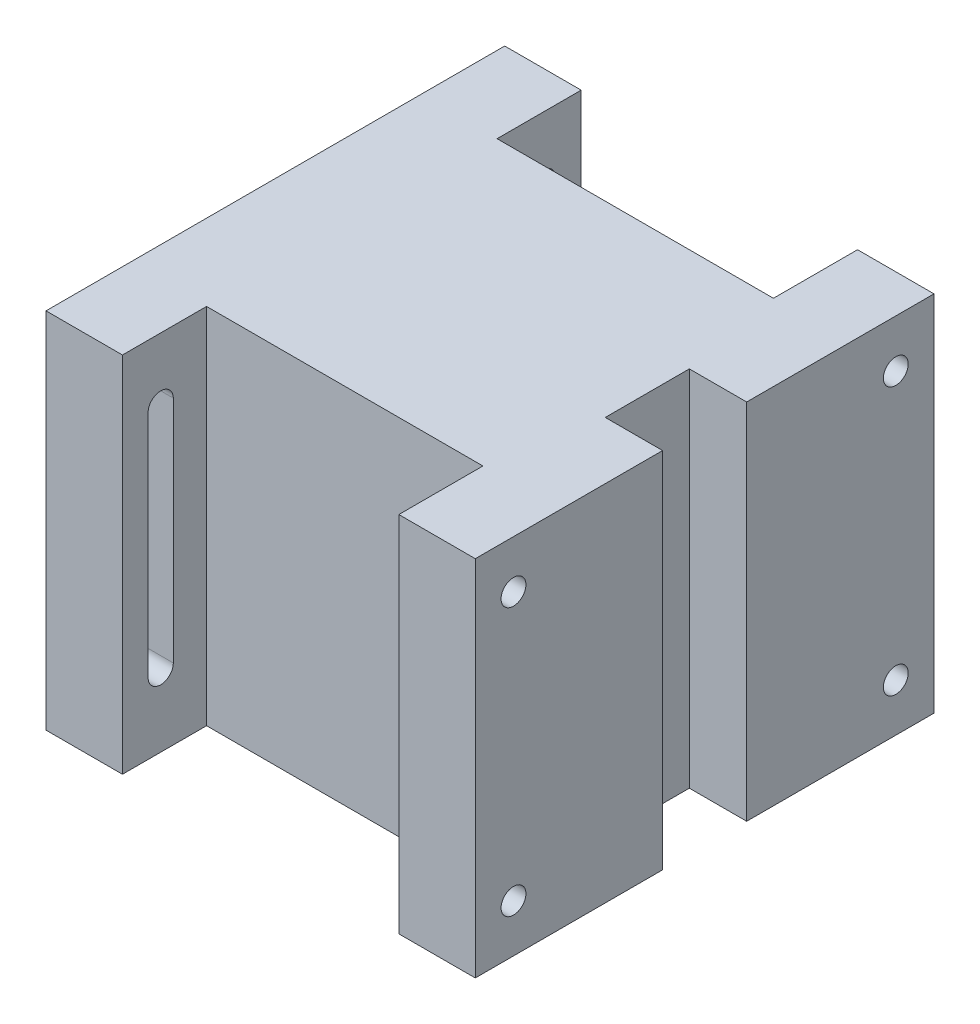
from build123d import *

# Parameters (mm, degrees)
SKETCH_1_W          = 112.3
SKETCH_1_H          = 95
EXTRUDE_1_DEPTH     = 120
SKETCH_2_W          = 72.3
SKETCH_2_H          = 22
CUT_EXTRUDE_1_DEPTH = 190.832268068
CUT_EXTRUDE_2_DEPTH = 25
SKETCH_4_R          = 3.25
CUT_EXTRUDE_3_DEPTH = 25
SKETCH_6_W          = 22
SKETCH_6_H          = 95
CUT_EXTRUDE_4_DEPTH = 15


with BuildPart() as part:
    # 草图1 → 凸台-拉伸1 (new body)
    with BuildSketch(Plane.XY):
        with Locations((56.15, 47.5)):
            Rectangle(SKETCH_1_W, SKETCH_1_H)
    extrude(amount=EXTRUDE_1_DEPTH)

    # 草图2 → 切除-拉伸1 (cut, through all)
    with BuildSketch(Plane.XZ):
        with Locations((56.15, 109)):
            Rectangle(SKETCH_2_W, SKETCH_2_H)
        with Locations((56.15, 11)):
            Rectangle(SKETCH_2_W, SKETCH_2_H)
    extrude(amount=-CUT_EXTRUDE_1_DEPTH, mode=Mode.SUBTRACT)

    # 草图3 → 切除-拉伸2 (cut)
    with BuildSketch(Plane.ZY):
        with BuildLine():
            Line((106.7, 18.576960217), (106.7, 78.576960217))
            ThreePointArc((106.7, 78.576960217), (110, 81.876960217), (113.3, 78.576960217))
            Line((113.3, 78.576960217), (113.3, 18.576960217))
            ThreePointArc((113.3, 18.576960217), (110, 15.276960217), (106.7, 18.576960217))
        make_face()
        with BuildLine():
            Line((13.3, 18.576960217), (13.3, 78.576960217))
            ThreePointArc((13.3, 78.576960217), (10, 81.876960217), (6.7, 78.576960217))
            Line((6.7, 78.576960217), (6.7, 18.576960217))
            ThreePointArc((6.7, 18.576960217), (10, 15.276960217), (13.3, 18.576960217))
        make_face()
    extrude(amount=-CUT_EXTRUDE_2_DEPTH, mode=Mode.SUBTRACT)

    # 草图4 → 切除-拉伸3 (cut)
    with BuildSketch(Plane(origin=(112.3, 0, 0), x_dir=(0, 0, -1), z_dir=(1, 0, 0))):
        with Locations((-110, 82.5)):
            Circle(SKETCH_4_R)
        with Locations((-10, 82.5)):
            Circle(SKETCH_4_R)
        with Locations((-10, 12.5)):
            Circle(SKETCH_4_R)
        with Locations((-110, 12.5)):
            Circle(SKETCH_4_R)
    extrude(amount=-CUT_EXTRUDE_3_DEPTH, mode=Mode.SUBTRACT)

    # 草图6 → 切除-拉伸4 (cut)
    with BuildSketch(Plane(origin=(112.3, 0, 0), x_dir=(0, 0, -1), z_dir=(1, 0, 0))):
        with Locations((-60, 47.5)):
            Rectangle(SKETCH_6_W, SKETCH_6_H)
    extrude(amount=-CUT_EXTRUDE_4_DEPTH, mode=Mode.SUBTRACT)


solid = part.part
